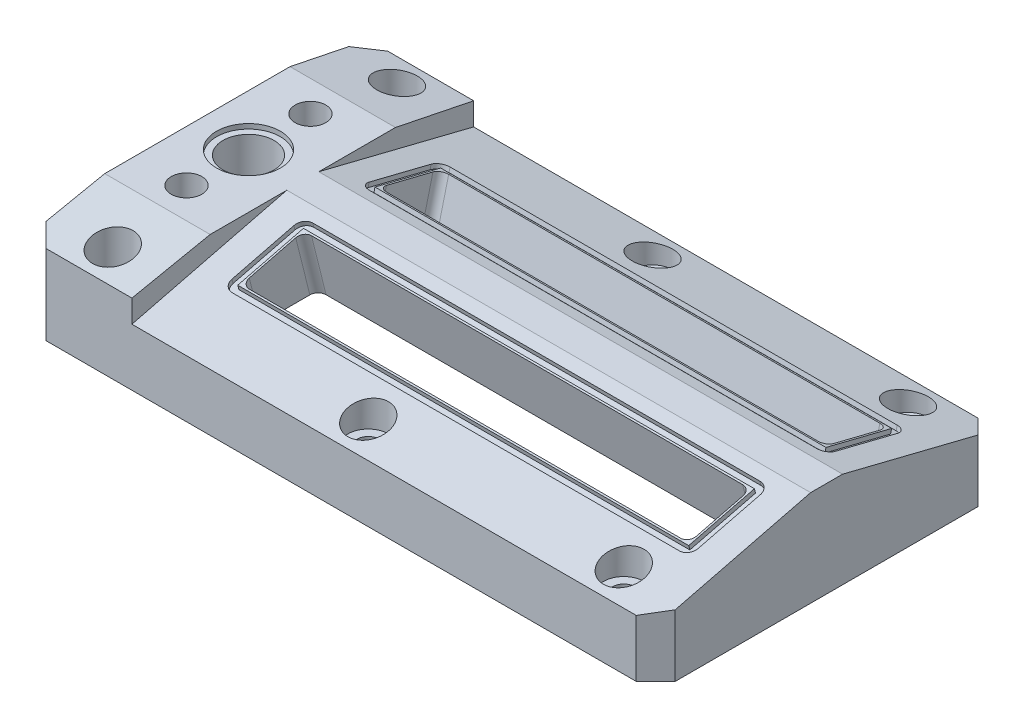
from build123d import *

# Parameters (mm, degrees)
SKETCH1_W           = 197
SKETCH1_H           = 107
BOSS_EXTRUDE1_DEPTH = 30
CUT_EXTRUDE1_DEPTH  = 227.181343174
SKETCH4_W           = 182
SKETCH4_H           = 45
CUT_EXTRUDE2_DEPTH  = 10
CUT_EXTRUDE3_DEPTH  = 164
SKETCH19_W          = 141.2
SKETCH19_H          = 21.2
CUT_EXTRUDE15_DEPTH = 1.4
SKETCH6_W           = 141.2
SKETCH6_H           = 21.2
CUT_EXTRUDE4_DEPTH  = 1.4
CUT_EXTRUDE5_REACH  = 228.181
SKETCH9_R           = 8
CUT_EXTRUDE6_DEPTH  = 171
SKETCH10_R          = 10
CUT_EXTRUDE7_DEPTH  = 1.5
SKETCH11_R          = 4.8
CUT_EXTRUDE8_DEPTH  = 12.5
SKETCH12_R          = 6.35
CUT_EXTRUDE9_DEPTH  = 17
CUT_EXTRUDE13_REACH = 225.36
SKETCH17_R          = 3.5
CUT_EXTRUDE14_DEPTH = 227.181343174
CUT_EXTRUDE16_REACH = 228.847


with BuildPart() as part:
    # Sketch1 → Boss-Extrude1 (new body)
    with BuildSketch(Plane(origin=(0, 0, 0), x_dir=(1, 0, 0), z_dir=(0, 1, 0))):
        with Locations((98.5, 53.5)):
            Rectangle(SKETCH1_W, SKETCH1_H)
    extrude(amount=BOSS_EXTRUDE1_DEPTH)

    # Sketch3 → Cut-Extrude1 (cut, through all)
    with BuildSketch(Plane(origin=(0, 30, 0), x_dir=(1, 0, 0), z_dir=(0, 1, 0))):
        Polygon((0, 0), (6.1, 0), (0, 6.1), align=None)
        Polygon((0, 107), (6.1, 107), (0, 100.9), align=None)
        Polygon((197, 100.9), (197, 107), (190.9, 107), align=None)
        Polygon((197, 6.1), (197, 0), (190.9, 0), align=None)
    extrude(amount=-CUT_EXTRUDE1_DEPTH, mode=Mode.SUBTRACT)

    # Sketch4 → Cut-Extrude2 (cut)
    with BuildSketch(Plane(origin=(0, 0, 0), x_dir=(1, 0, 0), z_dir=(0, 1, 0))):
        with Locations((98.5, 53.5)):
            Rectangle(SKETCH4_W, SKETCH4_H)
    extrude(amount=CUT_EXTRUDE2_DEPTH, mode=Mode.SUBTRACT)

    # Sketch5 → Cut-Extrude3 (cut)
    with BuildSketch(Plane(origin=(197, 0, 0), x_dir=(0, 0, -1), z_dir=(1, 0, 0))):
        Polygon((58.5, 30), (107, 17.907591862), (107, 30), align=None)
        Polygon((0, 17.907591862), (0, 30), (48.5, 30), align=None)
    extrude(amount=-CUT_EXTRUDE3_DEPTH, mode=Mode.SUBTRACT)

    # Sketch19 → Cut-Extrude15 (cut)
    with BuildSketch(Plane(origin=(0, 16.859528495, 4.203552569), x_dir=(1, 0, 0), z_dir=(0, 0.9702957262759979, 0.2419218955996617))):
        with BuildLine():
            Line((45, 24.332238569), (185, 24.332238569))
            ThreePointArc((185, 24.332238569), (187.121320344, 25.210918225), (188, 27.332238569))
            Line((188, 27.332238569), (188, 47.332238569))
            ThreePointArc((188, 47.332238569), (187.121320344, 49.453558912), (185, 50.332238569))
            Line((185, 50.332238569), (45, 50.332238569))
            ThreePointArc((45, 50.332238569), (42.878679656, 49.453558912), (42, 47.332238569))
            Line((42, 47.332238569), (42, 27.332238569))
            ThreePointArc((42, 27.332238569), (42.878679656, 25.210918225), (45, 24.332238569))
        make_face()
        with Locations((115, 37.332238569)):
            Rectangle(SKETCH19_W, SKETCH19_H, mode=Mode.SUBTRACT)
    extrude(amount=-CUT_EXTRUDE15_DEPTH, mode=Mode.SUBTRACT)

    # Sketch6 → Cut-Extrude4 (cut)
    with BuildSketch(Plane(origin=(0, 41.976257104, -10.465856351), x_dir=(1, 0, 0), z_dir=(0, 0.9702957262759981, -0.24192189559966115))):
        with BuildLine():
            Line((45, 79.489404143), (185, 79.489404143))
            ThreePointArc((185, 79.489404143), (187.121320344, 78.610724486), (188, 76.489404143))
            Line((188, 76.489404143), (188, 56.489404143))
            ThreePointArc((188, 56.489404143), (187.121320344, 54.368083799), (185, 53.489404143))
            Line((185, 53.489404143), (45, 53.489404143))
            ThreePointArc((45, 53.489404143), (42.878679656, 54.368083799), (42, 56.489404143))
            Line((42, 56.489404143), (42, 76.489404143))
            ThreePointArc((42, 76.489404143), (42.878679656, 78.610724486), (45, 79.489404143))
        make_face()
        with Locations((115, 66.489404143)):
            Rectangle(SKETCH6_W, SKETCH6_H, mode=Mode.SUBTRACT)
    extrude(amount=-CUT_EXTRUDE4_DEPTH, mode=Mode.SUBTRACT)

    # Cut-Extrude5: up to this face of the body (flat: up to its plane)
    cut_extrude5_end = Plane(part.part.faces().sort_by_distance((33, 25.969197287, -90.833333333))[0])
    # Sketch7 → Cut-Extrude5 (cut, up to the picked face)
    with BuildSketch(Plane(origin=(0, 0, 0), x_dir=(0, 0, -1), z_dir=(1, 0, 0)), mode=Mode.PRIVATE) as cut_extrude5_sk1:
        Polygon((107, 30), (107, 25), (82.505102572, 30), align=None)
    cut_extrude5_tool1 = split(extrude(cut_extrude5_sk1.sketch, amount=CUT_EXTRUDE5_REACH, mode=Mode.PRIVATE), bisect_by=cut_extrude5_end, keep=Keep.BOTH, mode=Mode.PRIVATE)
    # Sketch7 → Cut-Extrude5 (cut, up to the picked face)
    with BuildSketch(Plane(origin=(0, 0, 0), x_dir=(0, 0, -1), z_dir=(1, 0, 0)), mode=Mode.PRIVATE) as cut_extrude5_sk2:
        Polygon((0, 25), (0, 30), (24.494897428, 30), align=None)
    cut_extrude5_tool2 = split(extrude(cut_extrude5_sk2.sketch, amount=CUT_EXTRUDE5_REACH, mode=Mode.PRIVATE), bisect_by=cut_extrude5_end, keep=Keep.BOTH, mode=Mode.PRIVATE)
    add(cut_extrude5_tool1.solids().sort_by(Axis((0, 28.333333, -98.835034), (1, 0, 0)))[0], mode=Mode.SUBTRACT)
    add(cut_extrude5_tool2.solids().sort_by(Axis((0, 28.333333, -8.164966), (1, 0, 0)))[0], mode=Mode.SUBTRACT)

    # Sketch9 → Cut-Extrude6 (cut)
    with BuildSketch(Plane(origin=(0, 30, 0), x_dir=(1, 0, 0), z_dir=(0, 1, 0))):
        with Locations(Location((16, 53.5, 0), (0, 0, 270))):
            Circle(SKETCH9_R)
    extrude(amount=-CUT_EXTRUDE6_DEPTH, mode=Mode.SUBTRACT)

    # Sketch10 → Cut-Extrude7 (cut)
    with BuildSketch(Plane(origin=(0, 30, 0), x_dir=(1, 0, 0), z_dir=(0, 1, 0))):
        with Locations(Location((16, 53.5, 0), (0, 0, 270))):
            Circle(SKETCH10_R)
    extrude(amount=-CUT_EXTRUDE7_DEPTH, mode=Mode.SUBTRACT)

    # Sketch11 → Cut-Extrude8 (cut)
    with BuildSketch(Plane(origin=(0, 30, 0), x_dir=(1, 0, 0), z_dir=(0, 1, 0))):
        with Locations(Location((16, 72.905102572, 0), (0, 0, 270))):
            Circle(SKETCH11_R)
        with Locations(Location((16, 34.094897428, 0), (0, 0, 270))):
            Circle(SKETCH11_R)
    extrude(amount=-CUT_EXTRUDE8_DEPTH, mode=Mode.SUBTRACT)

    # Sketch12 → Cut-Extrude9 (cut)
    with BuildSketch(Plane(origin=(0, 30, 0), x_dir=(1, 0, 0), z_dir=(0, 1, 0))):
        with Locations(Location((18, 98, 0), (0, 0, 270))):
            Circle(SKETCH12_R)
        with Locations(Location((98, 9, 0), (0, 0, 270))):
            Circle(SKETCH12_R)
        with Locations(Location((178, 9, 0), (0, 0, 270))):
            Circle(SKETCH12_R)
        with Locations(Location((18, 9, 0), (0, 0, 270))):
            Circle(SKETCH12_R)
        with Locations(Location((98, 98, 0), (0, 0, 270))):
            Circle(SKETCH12_R)
        with Locations(Location((178, 98, 0), (0, 0, 270))):
            Circle(SKETCH12_R)
    extrude(amount=-CUT_EXTRUDE9_DEPTH, mode=Mode.SUBTRACT)

    # Cut-Extrude13: up to this plane
    cut_extrude13_end = Plane(origin=(0, 10, 0), z_dir=(0, -1, 0))
    # Sketch16 → Cut-Extrude13 (cut, up to the surface)
    with BuildSketch(Plane(origin=(0, 41.976257104, -10.465856351), x_dir=(1, 0, 0), z_dir=(0, 0.9702957262759981, -0.24192189559966115)), mode=Mode.PRIVATE) as cut_extrude13_sk1:
        with BuildLine():
            Line((47.5, 56.489404143), (182.5, 56.489404143))
            ThreePointArc((182.5, 56.489404143), (184.267766953, 57.22163719), (185, 58.989404143))
            Line((185, 58.989404143), (185, 73.989404143))
            ThreePointArc((185, 73.989404143), (184.267766953, 75.757171096), (182.5, 76.489404143))
            Line((182.5, 76.489404143), (47.5, 76.489404143))
            ThreePointArc((47.5, 76.489404143), (45.732233047, 75.757171096), (45, 73.989404143))
            Line((45, 73.989404143), (45, 58.989404143))
            ThreePointArc((45, 58.989404143), (45.732233047, 57.22163719), (47.5, 56.489404143))
        make_face()
    cut_extrude13_tool1 = split(extrude(cut_extrude13_sk1.sketch, amount=-CUT_EXTRUDE13_REACH, mode=Mode.PRIVATE), bisect_by=cut_extrude13_end, keep=Keep.BOTH, mode=Mode.PRIVATE)
    add(cut_extrude13_tool1.solids().sort_by_distance((115, 25.891014, -74.980241))[0], mode=Mode.SUBTRACT)

    # Sketch17 → Cut-Extrude14 (cut, through all)
    with BuildSketch(Plane(origin=(0, 30, 0), x_dir=(1, 0, 0), z_dir=(0, 1, 0))):
        with Locations(Location((18, 9, 0), (0, 0, 270))):
            Circle(SKETCH17_R)
        with Locations(Location((18, 98, 0), (0, 0, 270))):
            Circle(SKETCH17_R)
        with Locations(Location((98, 98, 0), (0, 0, 270))):
            Circle(SKETCH17_R)
        with Locations(Location((178, 98, 0), (0, 0, 270))):
            Circle(SKETCH17_R)
        with Locations(Location((178, 9, 0), (0, 0, 270))):
            Circle(SKETCH17_R)
        with Locations(Location((98, 9, 0), (0, 0, 270))):
            Circle(SKETCH17_R)
    extrude(amount=-CUT_EXTRUDE14_DEPTH, mode=Mode.SUBTRACT)

    # Cut-Extrude16: up to this plane
    cut_extrude16_end = Plane(origin=(0, 10, 0), z_dir=(0, -1, 0))
    # Sketch20 → Cut-Extrude16 (cut, up to the surface)
    with BuildSketch(Plane(origin=(0, 16.859528495, 4.203552569), x_dir=(1, 0, 0), z_dir=(0, 0.9702957262759979, 0.2419218955996617)), mode=Mode.PRIVATE) as cut_extrude16_sk1:
        with BuildLine():
            Line((47.5, 27.332238569), (182.5, 27.332238569))
            ThreePointArc((182.5, 27.332238569), (184.267766953, 28.064471616), (185, 29.832238569))
            Line((185, 29.832238569), (185, 44.832238569))
            ThreePointArc((185, 44.832238569), (184.267766953, 46.600005522), (182.5, 47.332238569))
            Line((182.5, 47.332238569), (47.5, 47.332238569))
            ThreePointArc((47.5, 47.332238569), (45.732233047, 46.600005522), (45, 44.832238569))
            Line((45, 44.832238569), (45, 29.832238569))
            ThreePointArc((45, 29.832238569), (45.732233047, 28.064471616), (47.5, 27.332238569))
        make_face()
    cut_extrude16_tool1 = split(extrude(cut_extrude16_sk1.sketch, amount=-CUT_EXTRUDE16_REACH, mode=Mode.PRIVATE), bisect_by=cut_extrude16_end, keep=Keep.BOTH, mode=Mode.PRIVATE)
    add(cut_extrude16_tool1.solids().sort_by_distance((115, 25.891014, -32.019759))[0], mode=Mode.SUBTRACT)


solid = part.part
